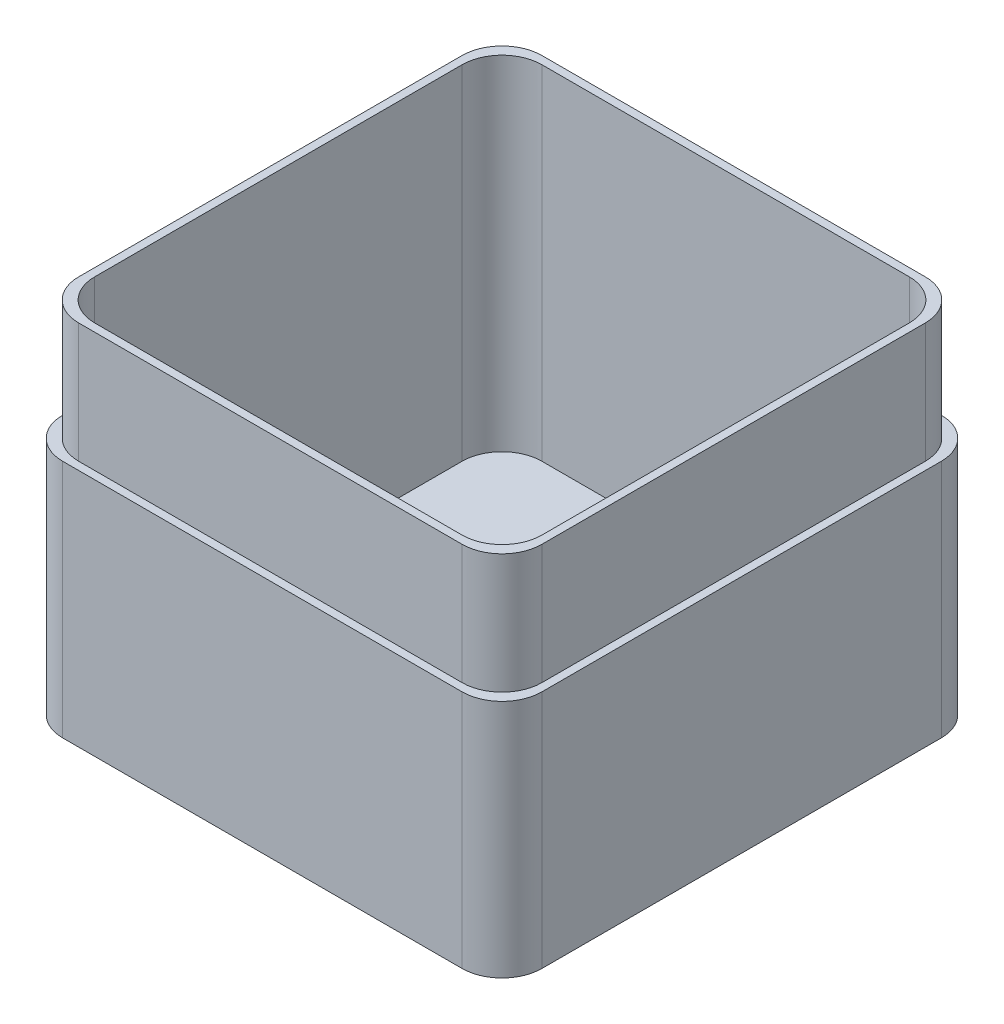
from build123d import *

# Parameters (mm, degrees)
CROQUIS2_W                   = 120
CROQUIS2_H                   = 120
SALIENTE_EXTRUIR1_DEPTH      = 90
VACIADO2_T                   = -4
CROQUIS3_W                   = 136
CROQUIS3_H                   = 136
CROQUIS3_W_2                 = 116
CROQUIS3_H_2                 = 116
CORTAR_EXTRUIR_L_MINA1_DEPTH = 30
REDONDEO3_R                  = 10


with BuildPart() as part:
    # Croquis2 → Saliente-Extruir1 (new body)
    with BuildSketch(Plane(origin=(0, 0, 0), x_dir=(1, 0, 0), z_dir=(0, 1, 0))):
        Rectangle(CROQUIS2_W, CROQUIS2_H)
    extrude(amount=SALIENTE_EXTRUIR1_DEPTH)

    # Vaciado2
    vaciado2_openings = [part.faces().sort_by_distance(p)[0] for p in [
        (0, 90, 0),
    ]]
    offset(amount=VACIADO2_T, openings=vaciado2_openings, kind=Kind.INTERSECTION)

    # Croquis3 → Cortar-Extruir-Lámina1 (cut)
    with BuildSketch(Plane(origin=(0, 90, 0), x_dir=(1, 0, 0), z_dir=(0, 1, 0))):
        Rectangle(CROQUIS3_W, CROQUIS3_H)
        Rectangle(CROQUIS3_W_2, CROQUIS3_H_2, mode=Mode.SUBTRACT)
    extrude(amount=-CORTAR_EXTRUIR_L_MINA1_DEPTH, mode=Mode.SUBTRACT)

    # Redondeo3
    redondeo3_edges = [part.edges().sort_by_distance(p)[0] for p in [
        (-56, 47, 56),
        (56, 47, 56),
        (-58, 75, -58),
        (-60, 30, -60),
        (58, 75, -58),
        (60, 30, -60),
        (60, 30, 60),
        (58, 75, 58),
        (-58, 75, 58),
        (-60, 30, 60),
        (-56, 47, -56),
        (56, 47, -56),
    ]]
    fillet(redondeo3_edges, radius=REDONDEO3_R)


solid = part.part
